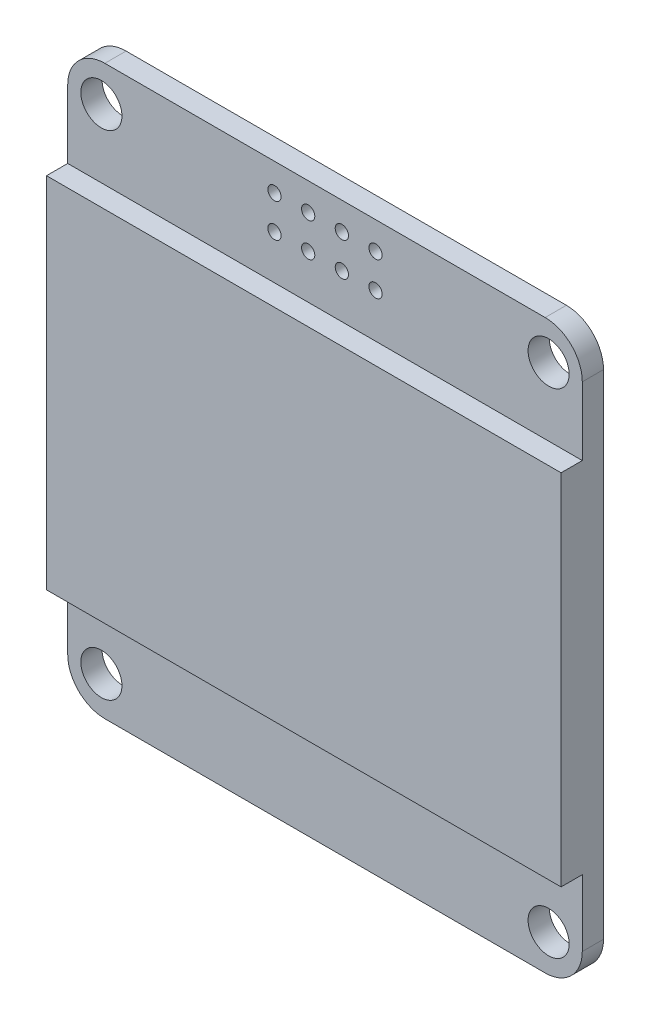
from build123d import *

# Parameters (mm, degrees)
SKIZZE1_R                       = 1.55
AUFSATZ_LINEAR_AUSTRAGEN1_DEPTH = 1.6
SKIZZE2_R                       = 0.5
SCHNITT_LINEAR_AUSTRAGEN1_DEPTH = 1.6
SKIZZE3_W                       = 38.8
SKIZZE3_H                       = 27.043851976
AUFSATZ_LINEAR_AUSTRAGEN2_DEPTH = 1.6
SKIZZE4_W                       = 3.86922581
SKIZZE4_H                       = 14.010670301
AUFSATZ_LINEAR_AUSTRAGEN3_DEPTH = 2


with BuildPart() as part:
    # Skizze1 → Aufsatz-Linear austragen1 (new body)
    with BuildSketch(Plane.XY):
        with BuildLine():
            Line((16.6, -21.4), (-16.6, -21.4))
            ThreePointArc((-16.6, -21.4), (-18.579898987, -20.579898987), (-19.4, -18.6))
            Line((-19.4, -18.6), (-19.4, 18.6))
            ThreePointArc((-19.4, 18.6), (-18.579898987, 20.579898987), (-16.6, 21.4))
            Line((-16.6, 21.4), (16.6, 21.4))
            ThreePointArc((16.6, 21.4), (18.579898987, 20.579898987), (19.4, 18.6))
            Line((19.4, 18.6), (19.4, -18.6))
            ThreePointArc((19.4, -18.6), (18.579898987, -20.579898987), (16.6, -21.4))
        make_face()
        with Locations((-16.861682243, 18.6)):
            Circle(SKIZZE1_R, mode=Mode.SUBTRACT)
        with Locations((-16.861682243, -18.6)):
            Circle(SKIZZE1_R, mode=Mode.SUBTRACT)
        with Locations((16.861682243, -18.6)):
            Circle(SKIZZE1_R, mode=Mode.SUBTRACT)
        with Locations((16.861682243, 18.6)):
            Circle(SKIZZE1_R, mode=Mode.SUBTRACT)
    extrude(amount=AUFSATZ_LINEAR_AUSTRAGEN1_DEPTH)

    # Skizze2 → Schnitt-Linear austragen1 (cut)
    with BuildSketch(Plane.XY.offset(1.6)):
        with Locations((-3.81, 16.782506105)):
            Circle(SKIZZE2_R)
        with Locations((-1.27, 16.782506105)):
            Circle(SKIZZE2_R)
        with Locations((1.27, 16.782506105)):
            Circle(SKIZZE2_R)
        with Locations((3.81, 16.782506105)):
            Circle(SKIZZE2_R)
        with Locations((-1.27, 19.322506105)):
            Circle(SKIZZE2_R)
        with Locations((1.27, 19.322506105)):
            Circle(SKIZZE2_R)
        with Locations((3.81, 19.322506105)):
            Circle(SKIZZE2_R)
        with Locations((-3.81, 19.322506105)):
            Circle(SKIZZE2_R)
    extrude(amount=-SCHNITT_LINEAR_AUSTRAGEN1_DEPTH, mode=Mode.SUBTRACT)

    # Skizze3 → Aufsatz-Linear austragen2 (add)
    with BuildSketch(Plane.XY.offset(1.6)):
        with Locations((0, -0.061093039)):
            Rectangle(SKIZZE3_W, SKIZZE3_H)
    extrude(amount=AUFSATZ_LINEAR_AUSTRAGEN2_DEPTH)

    # Skizze4 → Aufsatz-Linear austragen3 (add)
    with BuildSketch(Plane(origin=(0, 0, 0), x_dir=(-1, 0, 0), z_dir=(0, 0, -1))):
        with Locations((10.304359262, 0.631294738)):
            Rectangle(SKIZZE4_W, SKIZZE4_H)
    extrude(amount=AUFSATZ_LINEAR_AUSTRAGEN3_DEPTH)


solid = part.part
